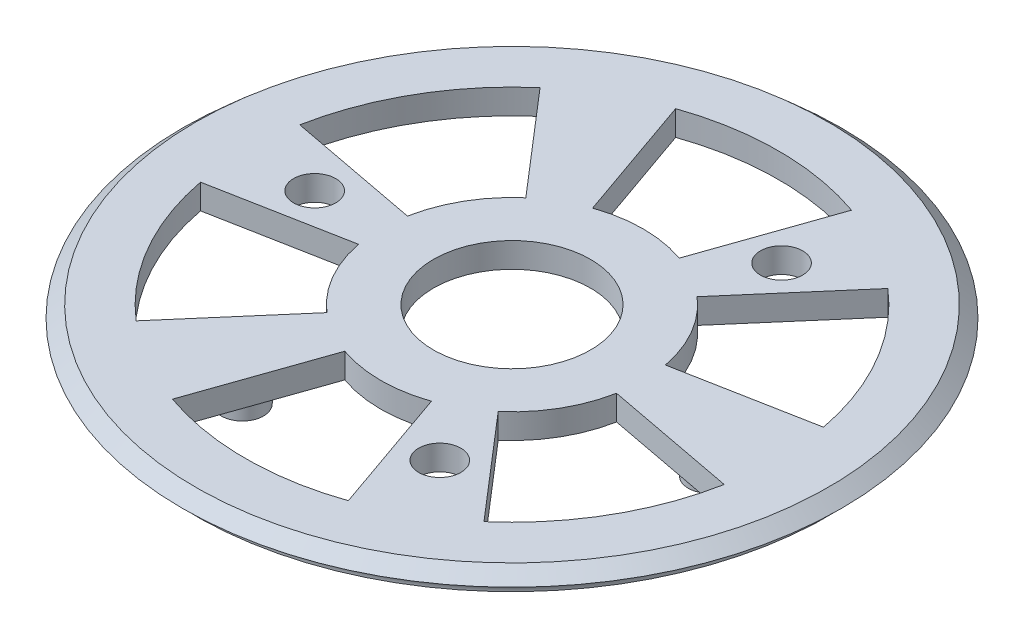
from build123d import *

# Parameters (mm, degrees)
BOSS_EXTRUDE1_START = -3
SKETCH2_R           = 9.461289508
BOSS_EXTRUDE1_DEPTH = 3
SKETCH3_R           = 2.54
BOSS_EXTRUDE2_DEPTH = 6
SKETCH4_R           = 2.54
CUT_EXTRUDE1_DEPTH  = 3


with BuildPart() as part:
    # Sketch1 → Revolve1 (revolve)
    with BuildSketch(Plane.XY, mode=Mode.PRIVATE) as revolve1_sk:
        with BuildLine():
            Line((-3, 3), (-3, 0))
            Line((-3, 0), (3, 0))
            ThreePointArc((3, 0), (3.464967985, 1.122532015), (4.5875, 1.5875))
            Line((4.5875, 1.5875), (3, 3))
            Line((3, 3), (0, 3))
            Line((0, 3), (-3, 3))
        make_face()
    revolve(revolve1_sk.sketch.rotate(Axis((-35.1, 18.916479231, 0), (0, -1, 0)), 180), axis=Axis((-35.1, 18.916479231, 0), (0, -1, 0)))

    # Sketch2 → Boss-Extrude1 (add)
    with BuildSketch(Plane(origin=(0, 3, 0), x_dir=(1, 0, 0), z_dir=(0, 1, 0)).offset(BOSS_EXTRUDE1_START)):
        with BuildLine():
            Line((-45.417440708, 11.981122365), (-56.04641595, 24.324014037))
            ThreePointArc((-56.04641595, 24.324014037), (-51.15, 27.799415461), (-45.692006103, 30.302135349))
            Line((-45.692006103, 30.302135349), (-40.31723598, 14.925726938))
            ThreePointArc((-40.31723598, 14.925726938), (-35.1, 15.811289508), (-29.88276402, 14.925726938))
            Line((-29.88276402, 14.925726938), (-24.507993897, 30.302135349))
            ThreePointArc((-24.507993897, 30.302135349), (-19.05, 27.799415461), (-14.15358405, 24.324014037))
            Line((-14.15358405, 24.324014037), (-24.782559292, 11.981122365))
            ThreePointArc((-24.782559292, 11.981122365), (-21.40702162, 7.905644754), (-19.565323312, 2.944604573))
            Line((-19.565323312, 2.944604573), (-3.561577947, 5.978121313))
            ThreePointArc((-3.561577947, 5.978121313), (-3, 0), (-3.561577947, -5.978121313))
            Line((-3.561577947, -5.978121313), (-19.565323312, -2.944604573))
            ThreePointArc((-19.565323312, -2.944604573), (-21.40702162, -7.905644754), (-24.782559292, -11.981122365))
            Line((-24.782559292, -11.981122365), (-14.15358405, -24.324014037))
            ThreePointArc((-14.15358405, -24.324014037), (-19.05, -27.799415461), (-24.507993897, -30.302135349))
            Line((-24.507993897, -30.302135349), (-29.88276402, -14.925726938))
            ThreePointArc((-29.88276402, -14.925726938), (-35.1, -15.811289508), (-40.31723598, -14.925726938))
            Line((-40.31723598, -14.925726938), (-45.692006103, -30.302135349))
            ThreePointArc((-45.692006103, -30.302135349), (-51.15, -27.799415461), (-56.04641595, -24.324014037))
            Line((-56.04641595, -24.324014037), (-45.417440708, -11.981122365))
            ThreePointArc((-45.417440708, -11.981122365), (-48.79297838, -7.905644754), (-50.634676688, -2.944604573))
            Line((-50.634676688, -2.944604573), (-66.638422053, -5.978121313))
            ThreePointArc((-66.638422053, -5.978121313), (-67.2, 0), (-66.638422053, 5.978121313))
            Line((-66.638422053, 5.978121313), (-50.634676688, 2.944604573))
            ThreePointArc((-50.634676688, 2.944604573), (-48.79297838, 7.905644754), (-45.417440708, 11.981122365))
        make_face()
        with Locations(Location((-35.1, 0, 0), (0, 0, 180))):
            Circle(SKETCH2_R, mode=Mode.SUBTRACT)
    extrude(amount=BOSS_EXTRUDE1_DEPTH)

    # Sketch3 → Boss-Extrude2 (add)
    with BuildSketch(Plane(origin=(0, 3, 0), x_dir=(1, 0, 0), z_dir=(0, 1, 0))):
        with Locations(Location((-46.983837426, 20.583410211, 0), (0, 0, 180))):
            Circle(SKETCH3_R)
        with Locations(Location((-11.332325148, 0, 0), (0, 0, 180))):
            Circle(SKETCH3_R)
        with Locations(Location((-46.983837426, -20.583410211, 0), (0, 0, 180))):
            Circle(SKETCH3_R)
    extrude(amount=-BOSS_EXTRUDE2_DEPTH)

    # Sketch4 → Cut-Extrude1 (cut)
    with BuildSketch(Plane(origin=(0, 3, 0), x_dir=(1, 0, 0), z_dir=(0, 1, 0))):
        with Locations(Location((-23.216162574, 20.583410211, 0), (0, 0, 180))):
            Circle(SKETCH4_R)
        with Locations(Location((-23.216162574, -20.583410211, 0), (0, 0, 180))):
            Circle(SKETCH4_R)
        with Locations(Location((-58.867674852, 0, 0), (0, 0, 180))):
            Circle(SKETCH4_R)
    extrude(amount=-CUT_EXTRUDE1_DEPTH, mode=Mode.SUBTRACT)


solid = part.part
